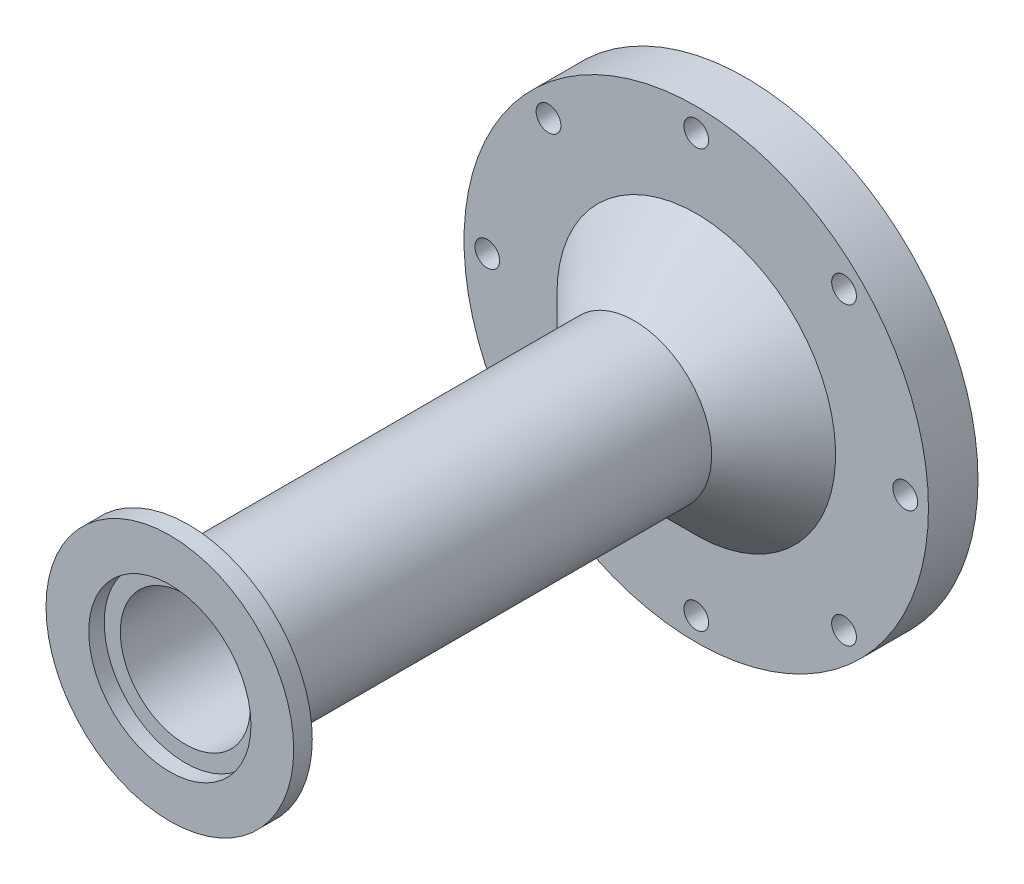
from build123d import *

# Parameters (mm, degrees)
SKETCH2_R           = 37.5
SKETCH2_R_2         = 5.35
BOSS_EXTRUDE2_DEPTH = 8
SKETCH14_R          = 2
CUT_EXTRUDE6_DEPTH  = 54.633012222
SKETCH3_R           = 20.71
SKETCH3_R_2         = 19.21
CUT_EXTRUDE2_DEPTH  = 2
SKETCH7_R           = 12.5
SKETCH7_R_2         = 10.5
BOSS_EXTRUDE4_DEPTH = 80
SKETCH10_R          = 12.5
BOSS_EXTRUDE5_DEPTH = 2.01
BOSS_EXTRUDE5_DRAFT = -75
SKETCH11_R          = 10.5
CUT_EXTRUDE3_DEPTH  = 105.4715277
BOSS_EXTRUDE6_START = 3
SKETCH12_R          = 20.001422123
SKETCH12_R_2        = 10.5
BOSS_EXTRUDE6_DEPTH = 3
SKETCH13_R          = 13.1
CUT_EXTRUDE4_DEPTH  = 2.5
CHAMFER1_SIZE       = 10


with BuildPart() as part:
    # Sketch2 → Boss-Extrude2 (new body)
    with BuildSketch(Plane.XY):
        Circle(SKETCH2_R)
        Circle(SKETCH2_R_2, mode=Mode.SUBTRACT)
    extrude(amount=BOSS_EXTRUDE2_DEPTH)

    # Sketch14 → Cut-Extrude6 (cut, through all)
    with BuildSketch(Plane.XY):
        with Locations((0, 33.75)):
            Circle(SKETCH14_R)
        with Locations((-23.864853865, 23.864853865)):
            Circle(SKETCH14_R)
        with Locations((-33.75, 0)):
            Circle(SKETCH14_R)
        with Locations((-23.864853865, -23.864853865)):
            Circle(SKETCH14_R)
        with Locations((0, -33.75)):
            Circle(SKETCH14_R)
        with Locations((23.864853865, -23.864853865)):
            Circle(SKETCH14_R)
        with Locations((33.75, 0)):
            Circle(SKETCH14_R)
        with Locations((23.864853865, 23.864853865)):
            Circle(SKETCH14_R)
    extrude(amount=CUT_EXTRUDE6_DEPTH, mode=Mode.SUBTRACT)

    # Sketch3 → Cut-Extrude2 (cut)
    with BuildSketch(Plane.XY):
        Circle(SKETCH3_R)
        Circle(SKETCH3_R_2, mode=Mode.SUBTRACT)
    extrude(amount=CUT_EXTRUDE2_DEPTH, mode=Mode.SUBTRACT)

    # Sketch7 → Boss-Extrude4 (add)
    with BuildSketch(Plane.XY.offset(8)):
        Circle(SKETCH7_R)
        Circle(SKETCH7_R_2, mode=Mode.SUBTRACT)
    extrude(amount=BOSS_EXTRUDE4_DEPTH)


with BuildPart() as boss_extrude5_tool:
    # Sketch10 → Boss-Extrude5 (with draft: the straight prism first)
    with BuildSketch(Plane.XY.offset(88)):
        Circle(SKETCH10_R)
    extrude(amount=BOSS_EXTRUDE5_DEPTH)
    # Boss-Extrude5: the draft: its side faces are tilted about the plane it starts from
    boss_extrude5_sides = [boss_extrude5_tool.faces().sort_by_distance(p)[0] for p in [
        (-12.5, 0, 89.005),
    ]]
    draft(boss_extrude5_sides, Plane.XY.offset(88), BOSS_EXTRUDE5_DRAFT)


with BuildPart() as part_1:
    add(part.part)

    # Boss-Extrude5: add boss_extrude5_tool
    add(boss_extrude5_tool.part)

    # Sketch11 → Cut-Extrude3 (cut, through all)
    with BuildSketch(Plane.XY.offset(90.01)):
        Circle(SKETCH11_R)
    extrude(amount=-CUT_EXTRUDE3_DEPTH, mode=Mode.SUBTRACT)

    # Sketch12 → Boss-Extrude6 (add)
    with BuildSketch(Plane.XY.offset(90.01).offset(BOSS_EXTRUDE6_START)):
        Circle(SKETCH12_R)
        Circle(SKETCH12_R_2, mode=Mode.SUBTRACT)
    extrude(amount=-BOSS_EXTRUDE6_DEPTH)

    # Sketch13 → Cut-Extrude4 (cut)
    with BuildSketch(Plane.XY.offset(93.01)):
        Circle(SKETCH13_R)
    extrude(amount=-CUT_EXTRUDE4_DEPTH, mode=Mode.SUBTRACT)

    # Chamfer1
    chamfer1_edges = [part_1.edges().sort_by_distance(p)[0] for p in [
        (-12.5, 0, 8),
    ]]
    chamfer(chamfer1_edges, length=CHAMFER1_SIZE)


solid = part_1.part
